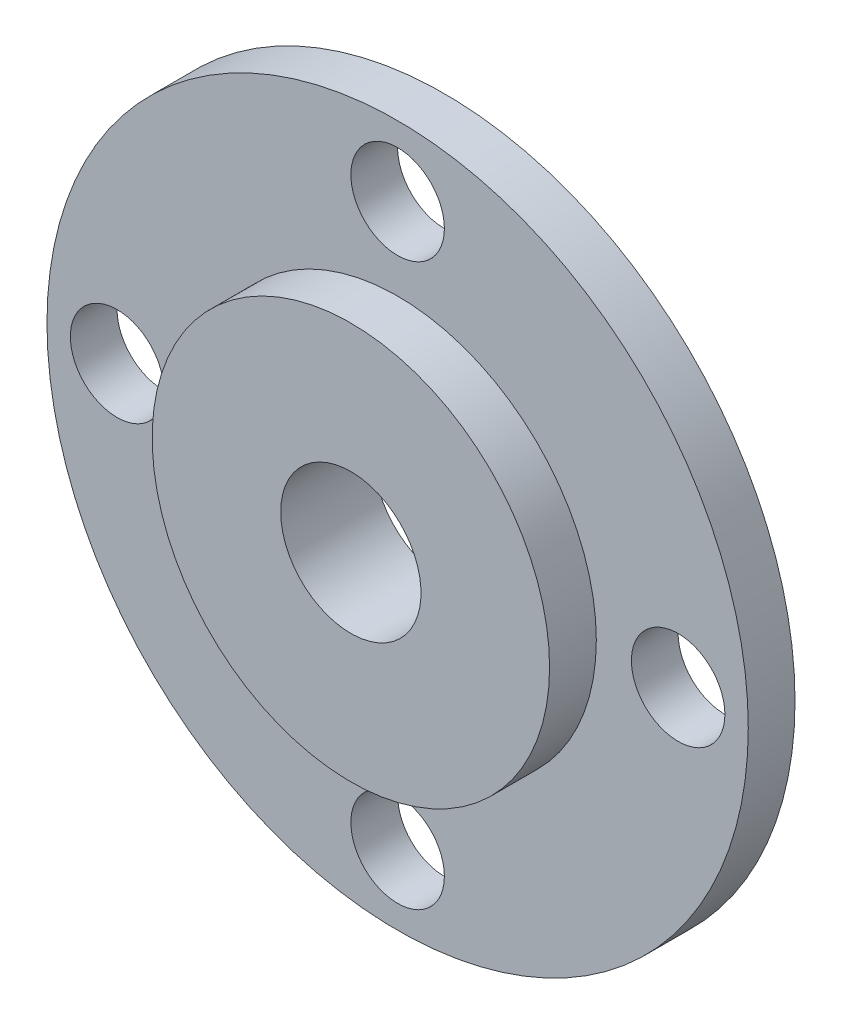
from build123d import *

# Parameters (mm, degrees)
SKETCH_1_R          = 4.25
EXTRUDE_1_DEPTH     = 1
SKETCH_2_R          = 7.5
EXTRUDE_2_DEPTH     = 1
SKETCH_3_R          = 1
CUT_EXTRUDE_1_DEPTH = 1
SKETCH_4_R          = 1.5
CUT_EXTRUDE_2_DEPTH = 11.793516572


with BuildPart() as part:
    # 草图1 → 凸台-拉伸1 (new body)
    with BuildSketch(Plane.XY):
        Circle(SKETCH_1_R)
    extrude(amount=EXTRUDE_1_DEPTH)

    # 草图2 → 凸台-拉伸2 (add)
    with BuildSketch(Plane(origin=(0, 0, 0), x_dir=(-1, 0, 0), z_dir=(0, 0, -1))):
        Circle(SKETCH_2_R)
    extrude(amount=EXTRUDE_2_DEPTH)

    # 草图3 → 切除-拉伸1 (cut)
    with BuildSketch(Plane.XY):
        with Locations((6, 0)):
            Circle(SKETCH_3_R)
        with Locations((0, 6)):
            Circle(SKETCH_3_R)
        with Locations((-6, 0)):
            Circle(SKETCH_3_R)
        with Locations((0, -6)):
            Circle(SKETCH_3_R)
    extrude(amount=-CUT_EXTRUDE_1_DEPTH, mode=Mode.SUBTRACT)

    # 草图4 → 切除-拉伸2 (cut, through all)
    with BuildSketch(Plane(origin=(0, 0, -1), x_dir=(-1, 0, 0), z_dir=(0, 0, -1))):
        Circle(SKETCH_4_R)
    extrude(amount=-CUT_EXTRUDE_2_DEPTH, mode=Mode.SUBTRACT)


solid = part.part
